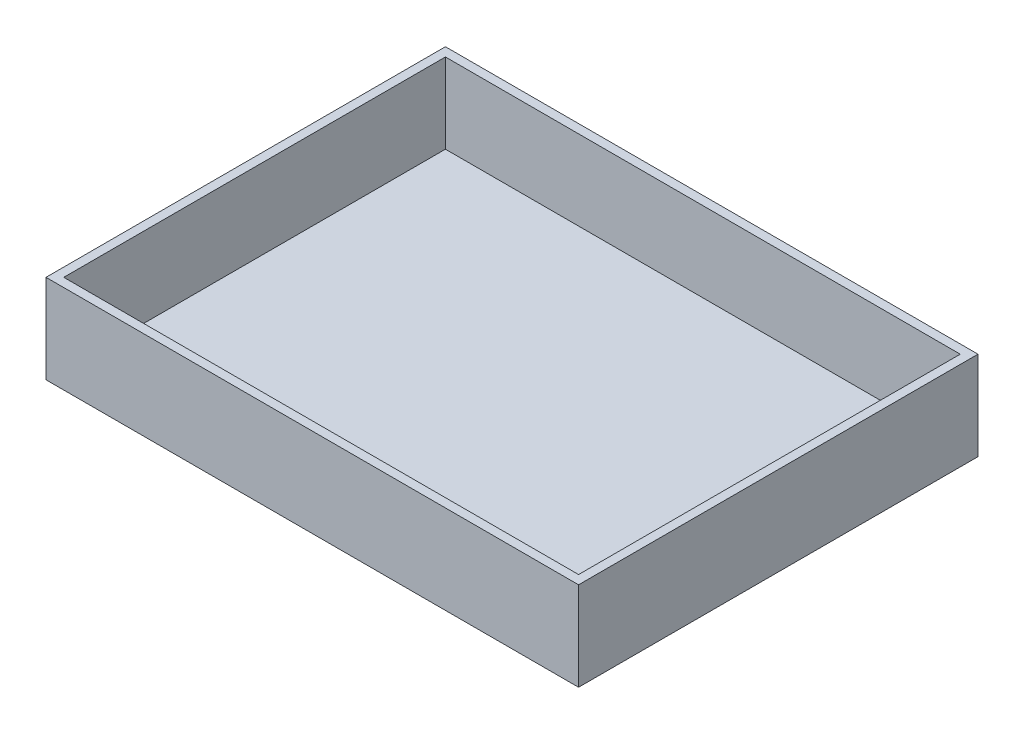
from build123d import *

# Parameters (mm, degrees)
CROQUIS1_W              = 600
CROQUIS1_H              = 100
SALIENTE_EXTRUIR1_DEPTH = 450
CROQUIS2_W              = 580
CROQUIS2_H              = 430
CORTAR_EXTRUIR1_DEPTH   = 90


with BuildPart() as part:
    # Croquis1 → Saliente-Extruir1 (new body)
    with BuildSketch(Plane.XY):
        with Locations((300, -50)):
            Rectangle(CROQUIS1_W, CROQUIS1_H)
    extrude(amount=-SALIENTE_EXTRUIR1_DEPTH)

    # Croquis2 → Cortar-Extruir1 (cut)
    with BuildSketch(Plane(origin=(0, 0, 0), x_dir=(1, 0, 0), z_dir=(0, 1, 0))):
        with Locations((300, 225)):
            Rectangle(CROQUIS2_W, CROQUIS2_H)
    extrude(amount=-CORTAR_EXTRUIR1_DEPTH, mode=Mode.SUBTRACT)


solid = part.part
